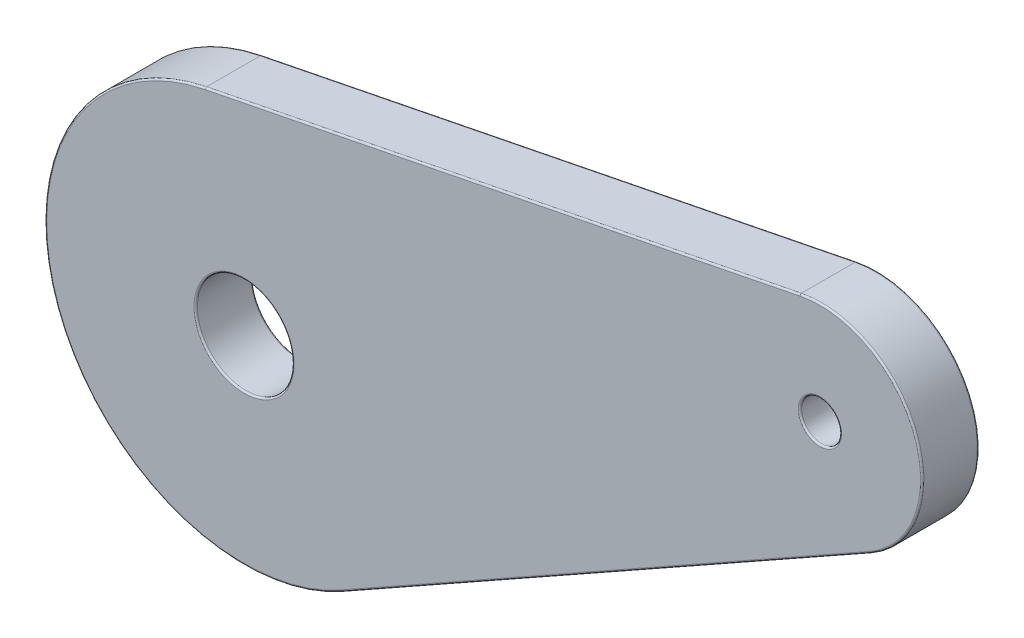
from build123d import *

# Parameters (mm, degrees)
SKETCH1_R           = 1.75
SKETCH1_R_2         = 4.25
BOSS_EXTRUDE1_DEPTH = 5
FILLET1_R           = 0.15


with BuildPart() as part:
    # Sketch1 → Boss-Extrude1 (new body)
    with BuildSketch(Plane.XY):
        with BuildLine():
            Line((-23.642096491, 74.742146008), (28.655201465, 85.170119277))
            ThreePointArc((28.655201465, 85.170119277), (38.854326271, 79.471184885), (34.831854011, 68.502150428))
            Line((34.831854011, 68.502150428), (-11.631938763, 42.332206579))
            ThreePointArc((-11.631938763, 42.332206579), (-36.629535075, 51.49911531), (-23.642096491, 74.742146008))
        make_face()
        with Locations((30.415136803, 76.343872758)):
            Circle(SKETCH1_R, mode=Mode.SUBTRACT)
        with Locations((-20.22, 57.58)):
            Circle(SKETCH1_R_2, mode=Mode.SUBTRACT)
    extrude(amount=BOSS_EXTRUDE1_DEPTH)

    # Fillet1
    fillet1_edges = [part.edges().sort_by_distance(p)[0] for p in [
        (28.665136803, 76.343872758, 0),
        (28.665136803, 76.343872758, 5),
        (38.854326271, 79.471184885, 5),
        (-24.47, 57.58, 0),
        (-24.47, 57.58, 5),
        (2.506552487, 79.956132643, 5),
        (-36.629535075, 51.49911531, 5),
        (2.506552487, 79.956132643, 0),
        (38.854326271, 79.471184885, 0),
        (11.599957624, 55.417178504, 0),
        (-36.629535075, 51.49911531, 0),
        (11.599957624, 55.417178504, 5),
    ]]
    fillet(fillet1_edges, radius=FILLET1_R)


solid = part.part
